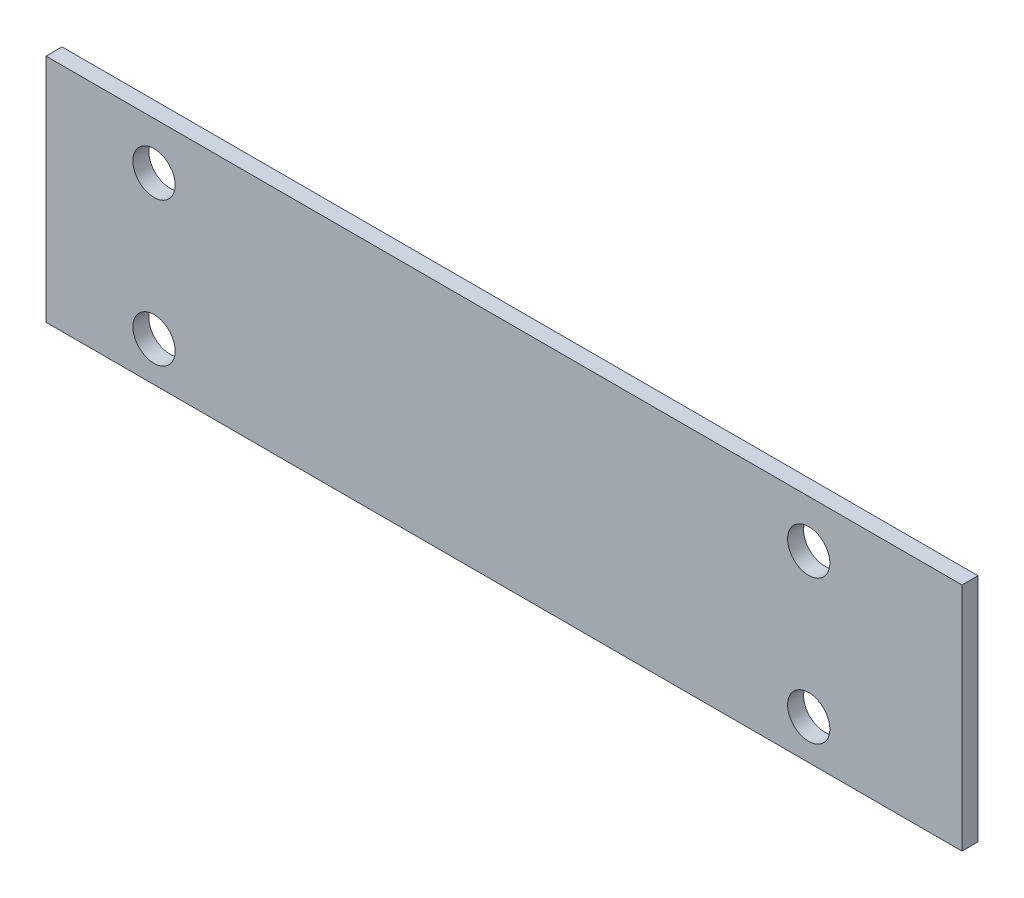
from build123d import *

# Parameters (mm, degrees)
SKETCH1_W           = 119.19
SKETCH1_H           = 30
SKETCH1_R           = 2.75
BOSS_EXTRUDE1_DEPTH = 1.04


with BuildPart() as part:
    # Sketch1 → Boss-Extrude1 (new, symmetric)
    with BuildSketch(Plane.XY):
        with Locations((-59.595, 15)):
            Rectangle(SKETCH1_W, SKETCH1_H)
        with Locations((-105.132851775, 23.85)):
            Circle(SKETCH1_R, mode=Mode.SUBTRACT)
        with Locations((-105.132851775, 5.15)):
            Circle(SKETCH1_R, mode=Mode.SUBTRACT)
        with Locations((-19.946740073, 23.85)):
            Circle(SKETCH1_R, mode=Mode.SUBTRACT)
        with Locations((-19.946740073, 5.15)):
            Circle(SKETCH1_R, mode=Mode.SUBTRACT)
    extrude(amount=BOSS_EXTRUDE1_DEPTH, both=True)


solid = part.part
